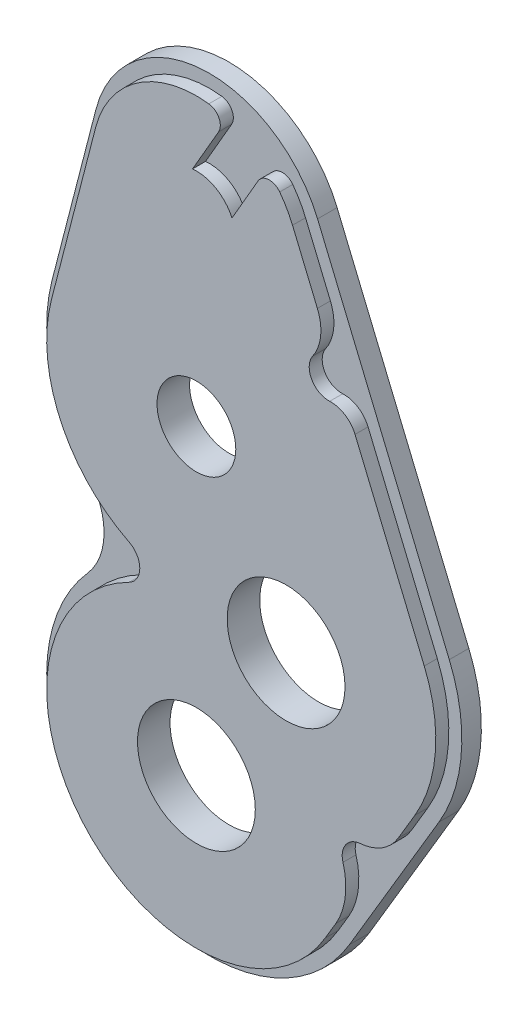
from build123d import *

# Parameters (mm, degrees)
SKETCH1_R           = 6.05
SKETCH1_R_2         = 9.05
BOSS_EXTRUDE1_DEPTH = 5
CUT_EXTRUDE1_START  = -2
CUT_EXTRUDE1_DEPTH  = 2


with BuildPart() as part:
    # Sketch1 → Boss-Extrude1 (new body)
    with BuildSketch(Plane.XY):
        with BuildLine():
            Line((-17.428425058, 4.5), (-24.206145914, -21.75))
            ThreePointArc((-24.206145914, -21.75), (-24.304944461, -33.854030643), (-18.705990528, -44.585714286))
            ThreePointArc((-18.705990528, -44.585714286), (-16.188386739, -51.22), (-18.705990528, -57.854285714))
            ThreePointArc((-18.705990528, -57.854285714), (-14.737892988, -94.633922608), (21.5, -87.197350822))
            Line((21.5, -87.197350822), (35.277938888, -63.977350822))
            ThreePointArc((35.277938888, -63.977350822), (38.71637128, -52.973450833), (36.851550967, -41.59667284))
            Line((36.851550967, -41.59667284), (16.613000697, 6.928795555))
            ThreePointArc((16.613000697, 6.928795555), (-1.281011782, 17.954359048), (-17.428425058, 4.5))
        make_face()
        with Locations((0, -28)):
            Circle(SKETCH1_R, mode=Mode.SUBTRACT)
        with Locations((13.777938888, -51.22)):
            Circle(SKETCH1_R_2, mode=Mode.SUBTRACT)
        with Locations((0, -74.44)):
            Circle(SKETCH1_R_2, mode=Mode.SUBTRACT)
    extrude(amount=BOSS_EXTRUDE1_DEPTH)

    # Sketch2 → Cut-Extrude1 (cut)
    with BuildSketch(Plane.XY.offset(5).offset(CUT_EXTRUDE1_START)):
        with BuildLine():
            Line((16.613000697, 6.928795555), (36.851550967, -41.59667284))
            ThreePointArc((36.851550967, -41.59667284), (38.71637128, -52.973450833), (35.277938888, -63.977350822))
            Line((35.277938888, -63.977350822), (21.5, -87.197350822))
            ThreePointArc((21.5, -87.197350822), (-14.737892988, -94.633922608), (-18.705990528, -57.854285714))
            ThreePointArc((-18.705990528, -57.854285714), (-16.188386739, -51.22), (-18.705990528, -44.585714286))
            ThreePointArc((-18.705990528, -44.585714286), (-24.304944461, -33.854030643), (-24.206145914, -21.75))
            Line((-24.206145914, -21.75), (-17.428425058, 4.5))
            ThreePointArc((-17.428425058, 4.5), (-1.281011782, 17.954359048), (16.613000697, 6.928795555))
        make_face()
        with BuildLine():
            Line((9.468285508, 9.39955156), (5.467787499, 2.470485754))
            ThreePointArc((5.467787499, 2.470485754), (3, 5.196152423), (-0.594390327, 5.970485754))
            Line((-0.594390327, 5.970485754), (3.406107682, 12.89955156))
            ThreePointArc((3.406107682, 12.89955156), (3.46289335, 14.794014563), (1.913207856, 15.885201783))
            ThreePointArc((1.913207856, 15.885201783), (-9.022746373, 13.213252737), (-15.491933385, 4))
            Line((-15.491933385, 4), (-22.269654241, -22.25))
            ThreePointArc((-22.269654241, -22.25), (-20.946970822, -37.498653241), (-10.347792006, -48.540769231))
            ThreePointArc((-10.347792006, -48.540769231), (-8.697504007, -51.22), (-10.347792006, -53.899230769))
            ThreePointArc((-10.347792006, -53.899230769), (-16.813726675, -90.133903125), (19.78, -86.176762756))
            Line((19.78, -86.176762756), (21.416047429, -83.419527323))
            ThreePointArc((21.416047429, -83.419527323), (22.868749584, -79.189380689), (22.517294907, -74.730573258))
            ThreePointArc((22.517294907, -74.730573258), (22.927957655, -72.188598464), (25.15802624, -70.901324657))
            ThreePointArc((25.15802624, -70.901324657), (28.527716294, -69.789192601), (31.009004018, -67.252490018))
            Line((31.009004018, -67.252490018), (33.557938888, -62.956762756))
            ThreePointArc((33.557938888, -62.956762756), (36.721296689, -52.833174766), (35.005662001, -42.366539013))
            Line((35.005662001, -42.366539013), (24.369440107, -16.864334436))
            ThreePointArc((24.369440107, -16.864334436), (22.811532345, -15.020784633), (20.47666212, -14.409120101))
            ThreePointArc((20.47666212, -14.409120101), (17.701744194, -12.866781789), (17.865596008, -9.696272437))
            ThreePointArc((17.865596008, -9.696272437), (19.084800596, -6.438585473), (18.585469893, -2.996252973))
            Line((18.585469893, -2.996252973), (14.76711173, 6.158929383))
            ThreePointArc((14.76711173, 6.158929383), (13.890682857, 7.940335621), (12.800384361, 9.599487498))
            ThreePointArc((12.800384361, 9.599487498), (11.080545761, 10.395960893), (9.468285508, 9.39955156))
        make_face(mode=Mode.SUBTRACT)
    extrude(amount=CUT_EXTRUDE1_DEPTH, mode=Mode.SUBTRACT)


solid = part.part
